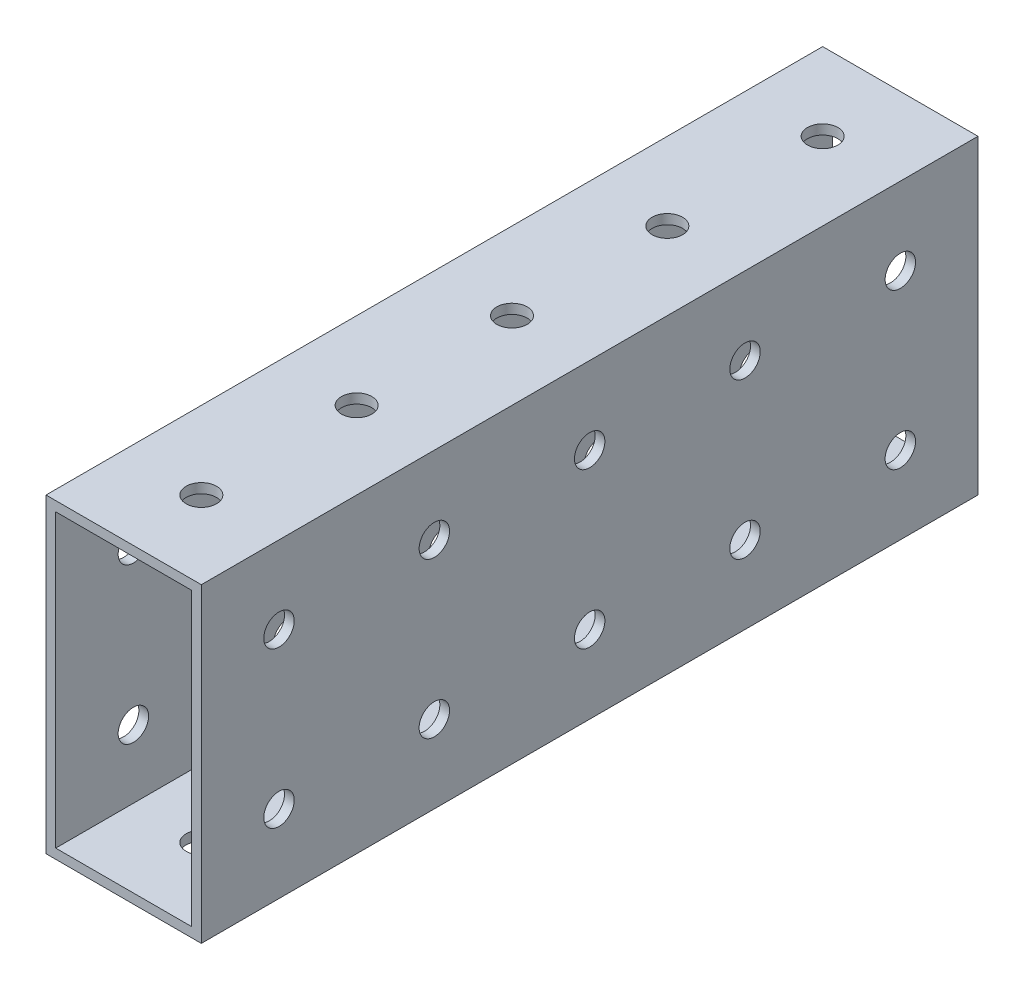
from build123d import *

# Parameters (mm, degrees)
SKETCH1_W           = 25.4
SKETCH1_H           = 50.8
BOSS_EXTRUDE1_DEPTH = 127
SHELL1_T            = -1.5875
SKETCH2_R           = 2.4892
CUT_EXTRUDE1_DEPTH  = 140.121529606
SKETCH3_R           = 2.4892
CUT_EXTRUDE2_DEPTH  = 140.121529606


with BuildPart() as part:
    # Sketch1 → Boss-Extrude1 (new body)
    with BuildSketch(Plane.XY):
        with Locations((12.7, 25.4)):
            Rectangle(SKETCH1_W, SKETCH1_H)
    extrude(amount=BOSS_EXTRUDE1_DEPTH)

    # Shell1
    shell1_openings = [part.faces().sort_by_distance(p)[0] for p in [
        (12.7, 25.4, 127),
        (12.7, 25.4, 0),
    ]]
    offset(amount=SHELL1_T, openings=shell1_openings, kind=Kind.INTERSECTION)

    # Sketch2 → Cut-Extrude1 (cut, through all)
    with BuildSketch(Plane.ZY):
        with Locations(Location((12.7, 12.7, 0), (0, 0, 270))):
            Circle(SKETCH2_R)
        with Locations(Location((38.1, 12.7, 0), (0, 0, 270))):
            Circle(SKETCH2_R)
        with Locations(Location((63.5, 12.7, 0), (0, 0, 270))):
            Circle(SKETCH2_R)
        with Locations(Location((88.9, 12.7, 0), (0, 0, 270))):
            Circle(SKETCH2_R)
        with Locations(Location((114.3, 12.7, 0), (0, 0, 270))):
            Circle(SKETCH2_R)
        with Locations(Location((38.1, 38.1, 0), (0, 0, 270))):
            Circle(SKETCH2_R)
        with Locations(Location((63.5, 38.1, 0), (0, 0, 270))):
            Circle(SKETCH2_R)
        with Locations(Location((88.9, 38.1, 0), (0, 0, 270))):
            Circle(SKETCH2_R)
        with Locations(Location((114.3, 38.1, 0), (0, 0, 270))):
            Circle(SKETCH2_R)
        with Locations(Location((12.7, 38.1, 0), (0, 0, 270))):
            Circle(SKETCH2_R)
    extrude(amount=-CUT_EXTRUDE1_DEPTH, mode=Mode.SUBTRACT)

    # Sketch3 → Cut-Extrude2 (cut, through all)
    with BuildSketch(Plane(origin=(0, 50.8, 0), x_dir=(1, 0, 0), z_dir=(0, 1, 0))):
        with Locations(Location((12.7, -12.7, 0), (0, 0, 270))):
            Circle(SKETCH3_R)
        with Locations(Location((12.7, -38.1, 0), (0, 0, 270))):
            Circle(SKETCH3_R)
        with Locations(Location((12.7, -63.5, 0), (0, 0, 270))):
            Circle(SKETCH3_R)
        with Locations(Location((12.7, -88.9, 0), (0, 0, 270))):
            Circle(SKETCH3_R)
        with Locations(Location((12.7, -114.3, 0), (0, 0, 270))):
            Circle(SKETCH3_R)
    extrude(amount=-CUT_EXTRUDE2_DEPTH, mode=Mode.SUBTRACT)


solid = part.part
